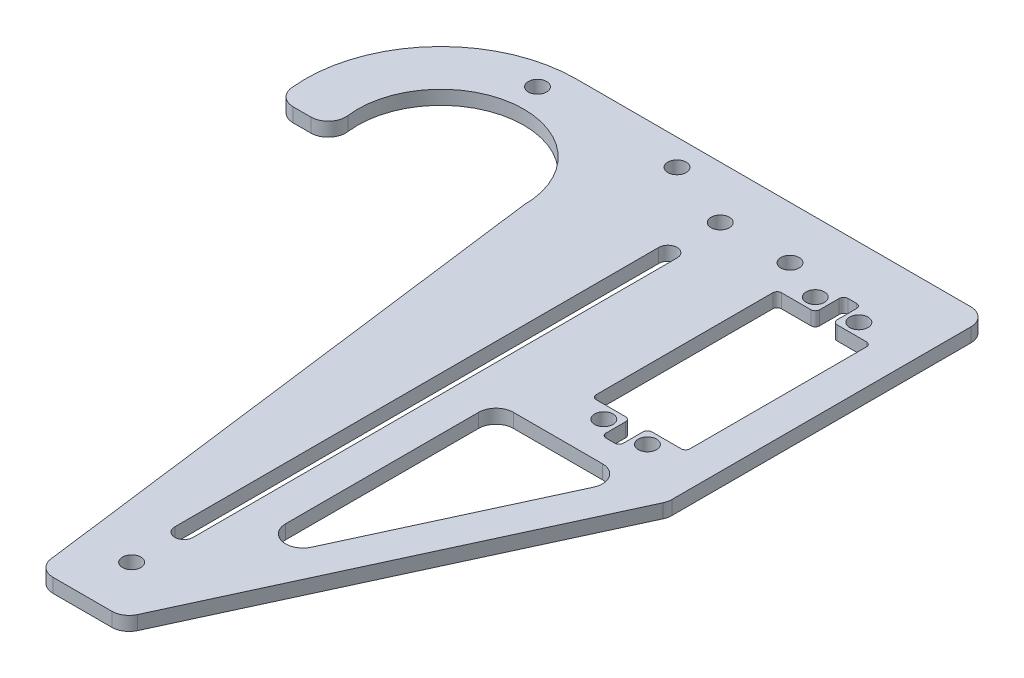
from build123d import *

# Parameters (mm, degrees)
SKETCH1_R           = 2.1
BOSS_EXTRUDE1_DEPTH = 3.2
FILLET1_R           = 4
FILLET2_R           = 1
SKETCH2_R           = 2.1
BOSS_EXTRUDE2_DEPTH = 3.2
FILLET3_R           = 4


with BuildPart() as part:
    # Sketch1 → Boss-Extrude1 (new body)
    with BuildSketch(Plane(origin=(0, 0, 0), x_dir=(1, 0, 0), z_dir=(0, 1, 0))):
        Polygon((10, 79.5), (49.480867985, 79.5), (49.480867985, 6.069914218), (10, -79.5), (-10, -79.5), (-10, 79.5), align=None)
        with Locations(Location((0, 67.5, 0), (0, 0, 270))):
            Circle(SKETCH1_R, mode=Mode.SUBTRACT)
        with Locations(Location((0, -67.5, 0), (0, 0, 270))):
            Circle(SKETCH1_R, mode=Mode.SUBTRACT)
        with Locations(Location((35.730867985, 63.569914218, 0), (0, 0, 270))):
            Circle(SKETCH1_R, mode=Mode.SUBTRACT)
        with Locations(Location((25.730867985, 63.569914218, 0), (0, 0, 270))):
            Circle(SKETCH1_R, mode=Mode.SUBTRACT)
        with Locations(Location((25.730867985, 15.069914218, 0), (0, 0, 270))):
            Circle(SKETCH1_R, mode=Mode.SUBTRACT)
        with Locations(Location((35.730867985, 15.069914218, 0), (0, 0, 270))):
            Circle(SKETCH1_R, mode=Mode.SUBTRACT)
        with Locations(Location((16, 67.5, 0), (0, 0, 270))):
            Circle(SKETCH1_R, mode=Mode.SUBTRACT)
        Polygon((19.980867985, 60.569914218), (28.730867985, 60.569914218), (28.730867985, 67.069914218), (32.730867985, 67.069914218), (32.730867985, 60.569914218), (41.480867985, 60.569914218), (41.480867985, 18.069914218), (32.730867985, 18.069914218), (32.730867985, 11.569914218), (28.730867985, 11.569914218), (28.730867985, 18.069914218), (19.980867985, 18.069914218), align=None, mode=Mode.SUBTRACT)
        with BuildLine():
            Line((-2.1, -55.5), (-2.1, 55.5))
            ThreePointArc((-2.1, 55.5), (0, 57.6), (2.1, 55.5))
            Line((2.1, 55.5), (2.1, -55.5))
            ThreePointArc((2.1, -55.5), (0, -57.6), (-2.1, -55.5))
        make_face(mode=Mode.SUBTRACT)
        Polygon((10, -60.404414159), (10, 6.069914218), (40.670408017, 6.069914218), align=None, mode=Mode.SUBTRACT)
    extrude(amount=BOSS_EXTRUDE1_DEPTH)

    # Fillet1
    fillet1_edges = [part.edges().sort_by_distance(p)[0] for p in [
        (-10, 1.6, -79.5),
        (49.480867985, 1.6, -79.5),
        (49.480867985, 1.6, -6.069914218),
        (10, 1.6, 79.5),
        (-10, 1.6, 79.5),
        (10, 1.6, 60.404414159),
        (40.670408017, 1.6, -6.069914218),
        (10, 1.6, -6.069914218),
    ]]
    fillet(fillet1_edges, radius=FILLET1_R)

    # Fillet2
    fillet2_edges = [part.edges().sort_by_distance(p)[0] for p in [
        (32.730867985, 1.6, -18.069914218),
        (41.480867985, 1.6, -18.069914218),
        (41.480867985, 1.6, -60.569914218),
        (32.730867985, 1.6, -60.569914218),
        (32.730867985, 1.6, -67.069914218),
        (28.730867985, 1.6, -67.069914218),
        (28.730867985, 1.6, -60.569914218),
        (19.980867985, 1.6, -60.569914218),
        (19.980867985, 1.6, -18.069914218),
        (28.730867985, 1.6, -18.069914218),
        (28.730867985, 1.6, -11.569914218),
        (32.730867985, 1.6, -11.569914218),
    ]]
    fillet(fillet2_edges, radius=FILLET2_R)

    # Sketch2 → Boss-Extrude2 (add)
    with BuildSketch(Plane(origin=(0, 3.2, 0), x_dir=(1, 0, 0), z_dir=(0, 1, 0))):
        with BuildLine():
            Line((-6, 79.5), (-45.05, 79.5))
            ThreePointArc((-45.05, 79.5), (-69.338886347, 67.793021998), (-75.312187627, 41.5))
            Line((-75.312187627, 41.5), (-62.786967046, 41.5))
            ThreePointArc((-62.786967046, 41.5), (-48.586472661, 67.168863777), (-26, 48.45))
            Line((-26, 48.45), (-10, -75.5))
            Line((-10, -75.5), (-10, 75.5))
            ThreePointArc((-10, 75.5), (-8.828427125, 78.328427125), (-6, 79.5))
        make_face()
        with Locations(Location((-47.914568138, 73.5, 0), (0, 0, 270))):
            Circle(SKETCH2_R, mode=Mode.SUBTRACT)
        with Locations(Location((-15.914568138, 73.5, 0), (0, 0, 270))):
            Circle(SKETCH2_R, mode=Mode.SUBTRACT)
    extrude(amount=-BOSS_EXTRUDE2_DEPTH)

    # Fillet3
    fillet3_edges = [part.edges().sort_by_distance(p)[0] for p in [
        (-62.786967046, 1.6, -41.5),
        (-75.312187627, 1.6, -41.5),
    ]]
    fillet(fillet3_edges, radius=FILLET3_R)


solid = part.part
